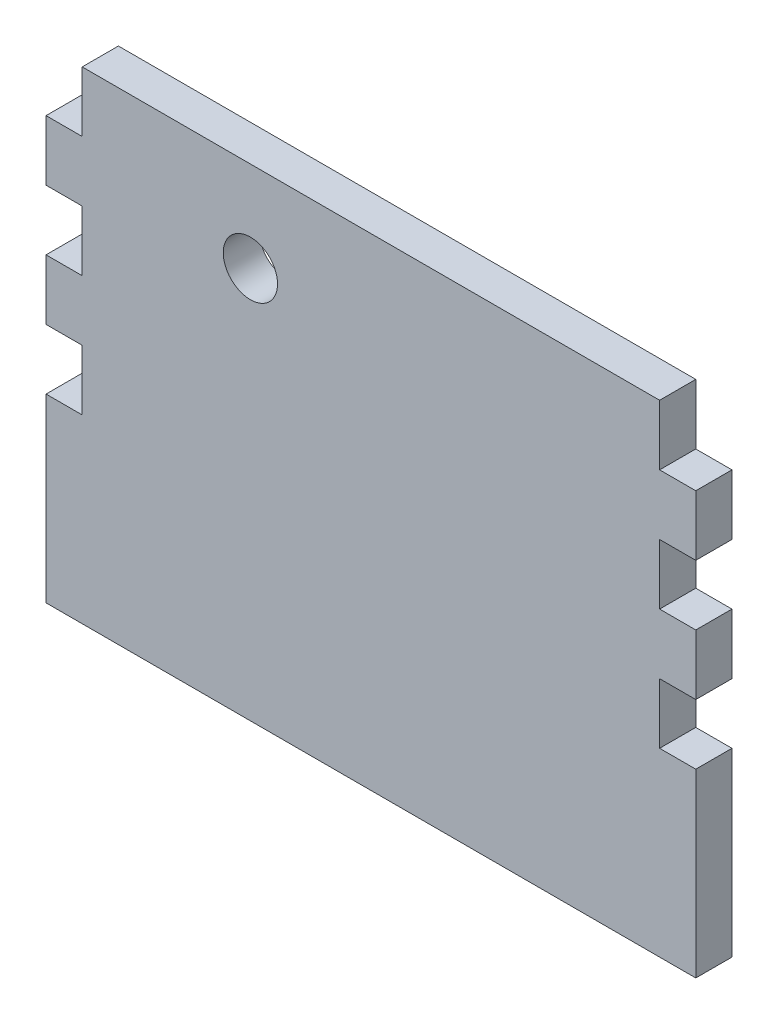
from build123d import *

# Parameters (mm, degrees)
SKETCH1_W           = 53.89
SKETCH1_H           = 40
BOSS_EXTRUDE1_DEPTH = 3
SKETCH2_R           = 2.25
SKETCH2_W           = 3
SKETCH2_H           = 5
CUT_EXTRUDE1_DEPTH  = 3


with BuildPart() as part:
    # Sketch1 → Boss-Extrude1 (new body)
    with BuildSketch(Plane.XY):
        Rectangle(SKETCH1_W, SKETCH1_H)
    extrude(amount=BOSS_EXTRUDE1_DEPTH)

    # Sketch2 → Cut-Extrude1 (cut)
    with BuildSketch(Plane.XY.offset(3)):
        with Locations((-9.995, 12.5)):
            Circle(SKETCH2_R)
        with Locations((-25.445, 17.5)):
            Rectangle(SKETCH2_W, SKETCH2_H)
        with Locations((-25.445, 7.5)):
            Rectangle(SKETCH2_W, SKETCH2_H)
        with Locations((25.445, 17.5)):
            Rectangle(SKETCH2_W, SKETCH2_H)
        with Locations((25.445, 7.5)):
            Rectangle(SKETCH2_W, SKETCH2_H)
        with Locations((25.445, -2.5)):
            Rectangle(SKETCH2_W, SKETCH2_H)
        with Locations((-25.445, -2.5)):
            Rectangle(SKETCH2_W, SKETCH2_H)
    extrude(amount=-CUT_EXTRUDE1_DEPTH, mode=Mode.SUBTRACT)


solid = part.part
